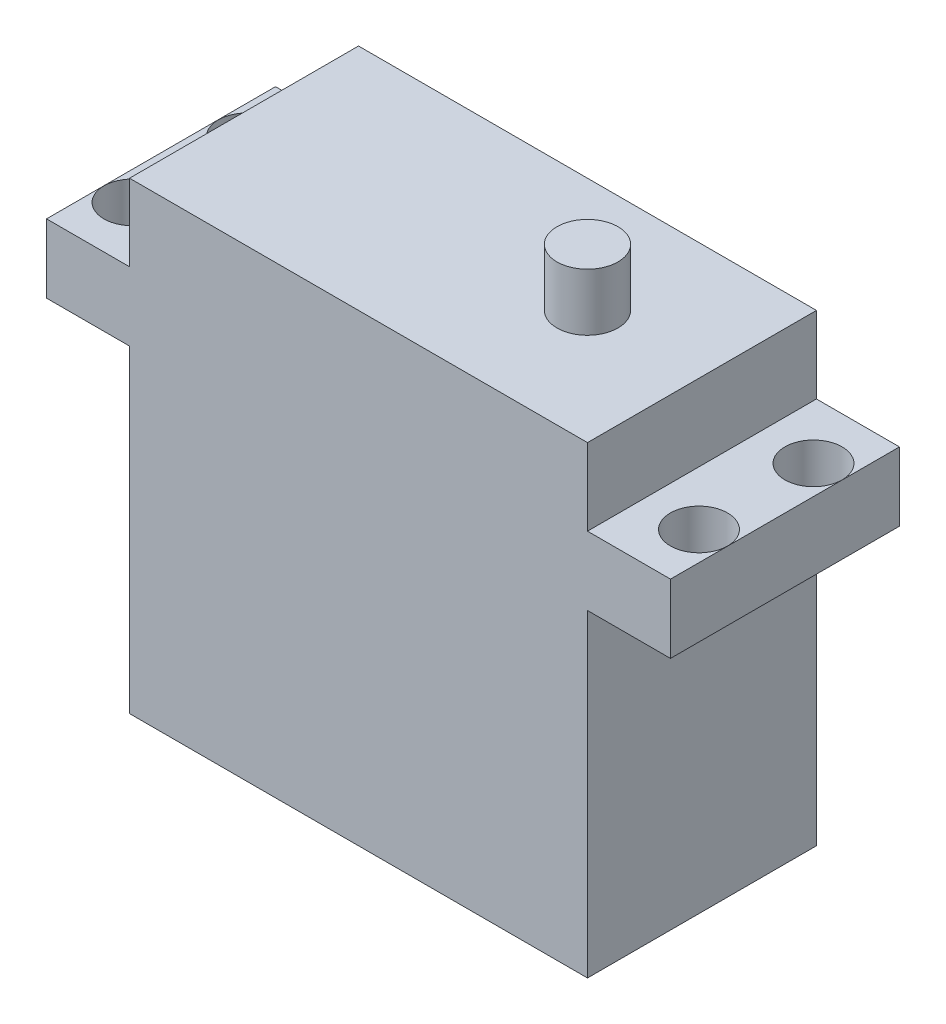
from build123d import *

# Parameters (mm, degrees)
SKETCH2_W           = 40
SKETCH2_H           = 20
BOSS_EXTRUDE1_DEPTH = 40.5
BOSS_EXTRUDE3_START = 27.8
SKETCH2_5_W         = 7.25
SKETCH2_5_H         = 20
SKETCH2_5_R         = 2.5
BOSS_EXTRUDE3_DEPTH = 6
SKETCH2_6_R         = 2.665211454
BOSS_EXTRUDE4_DEPTH = 45.5


with BuildPart() as part:
    # Sketch2 → Boss-Extrude1 (new body)
    with BuildSketch(Plane(origin=(0, 0, 0), x_dir=(1, 0, 0), z_dir=(0, 1, 0))):
        Rectangle(SKETCH2_W, SKETCH2_H)
    extrude(amount=BOSS_EXTRUDE1_DEPTH)

    # Sketch2<5> → Boss-Extrude3 (add)
    # profile 1 of 2: a face of its own
    with BuildSketch(Plane(origin=(0, 0, 0), x_dir=(1, 0, 0), z_dir=(0, 1, 0)).offset(BOSS_EXTRUDE3_START)):
        with Locations((-23.625, 0)):
            Rectangle(SKETCH2_5_W, SKETCH2_5_H)
        with Locations((-24.74, -5)):
            Circle(SKETCH2_5_R, mode=Mode.SUBTRACT)
        with Locations((-24.74, 5)):
            Circle(SKETCH2_5_R, mode=Mode.SUBTRACT)
    # profile 2 of 2: a face of its own
    with BuildSketch(Plane(origin=(0, 0, 0), x_dir=(1, 0, 0), z_dir=(0, 1, 0)).offset(BOSS_EXTRUDE3_START)):
        with Locations((23.625, 0)):
            Rectangle(SKETCH2_5_W, SKETCH2_5_H)
        with Locations((24.74, -5)):
            Circle(SKETCH2_5_R, mode=Mode.SUBTRACT)
        with Locations((24.74, 5)):
            Circle(SKETCH2_5_R, mode=Mode.SUBTRACT)
    extrude(amount=BOSS_EXTRUDE3_DEPTH)

    # Sketch2<6> → Boss-Extrude4 (add)
    with BuildSketch(Plane(origin=(0, 0, 0), x_dir=(1, 0, 0), z_dir=(0, 1, 0))):
        with Locations((10, 0)):
            Circle(SKETCH2_6_R)
    extrude(amount=BOSS_EXTRUDE4_DEPTH)


solid = part.part
